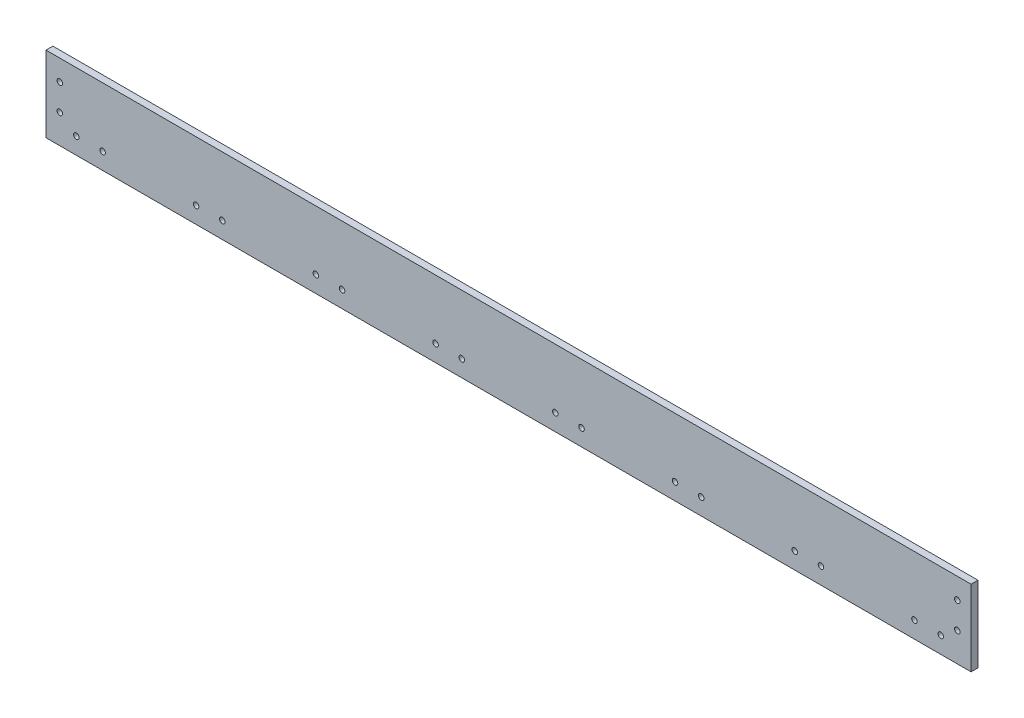
from build123d import *

# Parameters (mm, degrees)
SKETCH1_W           = 850.9
SKETCH1_H           = 69.85
BOSS_EXTRUDE1_DEPTH = 6.35
SKETCH2_R           = 2.54
CUT_EXTRUDE1_DEPTH  = 6.35
SKETCH3_R           = 2.54
CUT_EXTRUDE2_DEPTH  = 6.35
LPATTERN2_COUNT     = 8
LPATTERN2_PITCH     = 110.127142857


with BuildPart() as part:
    # Sketch1 → Boss-Extrude1 (new body)
    with BuildSketch(Plane.XY):
        with Locations((425.45, 34.925)):
            Rectangle(SKETCH1_W, SKETCH1_H)
    extrude(amount=BOSS_EXTRUDE1_DEPTH)

    # Sketch2 → Cut-Extrude1 (cut)
    with BuildSketch(Plane.XY.offset(6.35)):
        with Locations((27.94, 15.24)):
            Circle(SKETCH2_R)
        with Locations((52.07, 15.24)):
            Circle(SKETCH2_R)
    cut_extrude1 = extrude(amount=-CUT_EXTRUDE1_DEPTH, mode=Mode.SUBTRACT)

    # Sketch3 → Cut-Extrude2 (cut)
    with BuildSketch(Plane.XY.offset(6.35)):
        with Locations((12.7, 26.67)):
            Circle(SKETCH3_R)
        with Locations((12.7, 50.8)):
            Circle(SKETCH3_R)
        with Locations(Location((838.2, 26.67, 0), (0, 0, 180))):
            Circle(SKETCH3_R)
        with Locations(Location((838.2, 50.8, 0), (0, 0, 180))):
            Circle(SKETCH3_R)
    extrude(amount=-CUT_EXTRUDE2_DEPTH, mode=Mode.SUBTRACT)

    # LPattern2: Cut-Extrude1 ×8
    with Locations(*[(i * LPATTERN2_PITCH, 0, 0) for i in range(1, LPATTERN2_COUNT)]):
        add(cut_extrude1, mode=Mode.SUBTRACT)


solid = part.part
